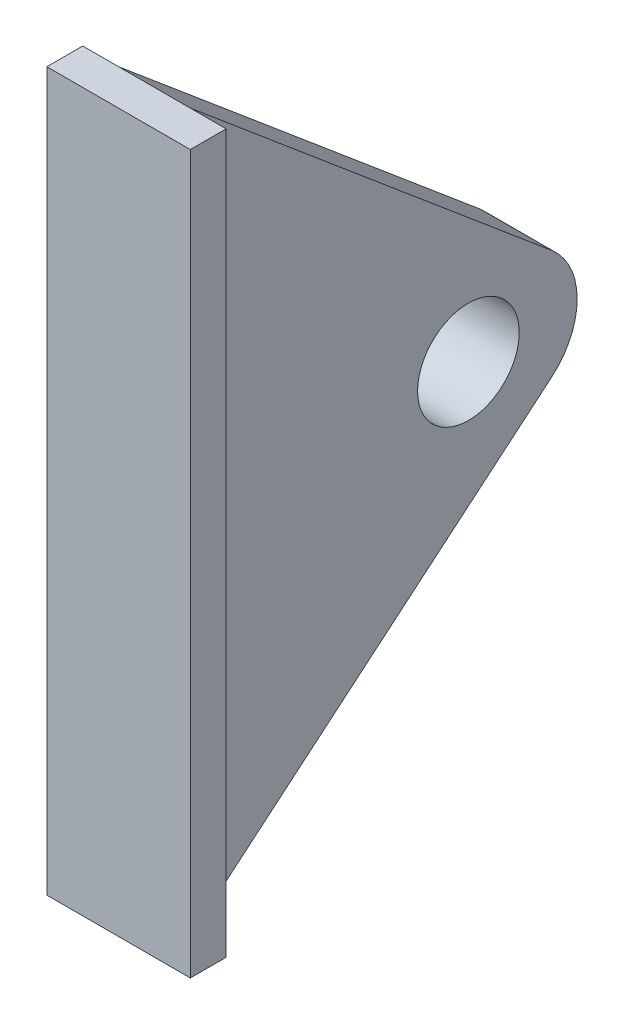
from build123d import *

# Parameters (mm, degrees)
SKETCH_1_W           = 12
SKETCH_1_H           = 60
EXTRUDE_1_DEPTH      = 3
EXTRUDE_2_DEPTH      = 3
EXTRUDE_2_DEPTH_BACK = 3
FILLET_1_R           = 6
SKETCH_4_R           = 4.25
CUT_EXTRUDE_1_DEPTH  = 46.029309177


with BuildPart() as part:
    # 草图1 → 凸台-拉伸1 (new body)
    with BuildSketch(Plane.XY):
        Rectangle(SKETCH_1_W, SKETCH_1_H)
    extrude(amount=EXTRUDE_1_DEPTH)

    # 草图3 → 凸台-拉伸2 (add, two sides: drawn at the far end of the back side and taken through both)
    with BuildSketch(Plane(origin=(0, 0, 0), x_dir=(0, 0, -1), z_dir=(1, 0, 0)).offset(-EXTRUDE_2_DEPTH_BACK)):
        Polygon((0, 30), (35.674118933, 0), (0, -30), align=None)
    extrude(amount=EXTRUDE_2_DEPTH + EXTRUDE_2_DEPTH_BACK)

    # 圆角1
    fillet_1_edges = [part.edges().sort_by_distance(p)[0] for p in [
        (0, 0, -35.674118933),
    ]]
    fillet(fillet_1_edges, radius=FILLET_1_R)

    # 草图4 → 切除-拉伸1 (cut, through all)
    with BuildSketch(Plane.ZY.offset(3)):
        with Locations((-23.257154685, 0)):
            Circle(SKETCH_4_R)
    extrude(amount=-CUT_EXTRUDE_1_DEPTH, mode=Mode.SUBTRACT)


solid = part.part
